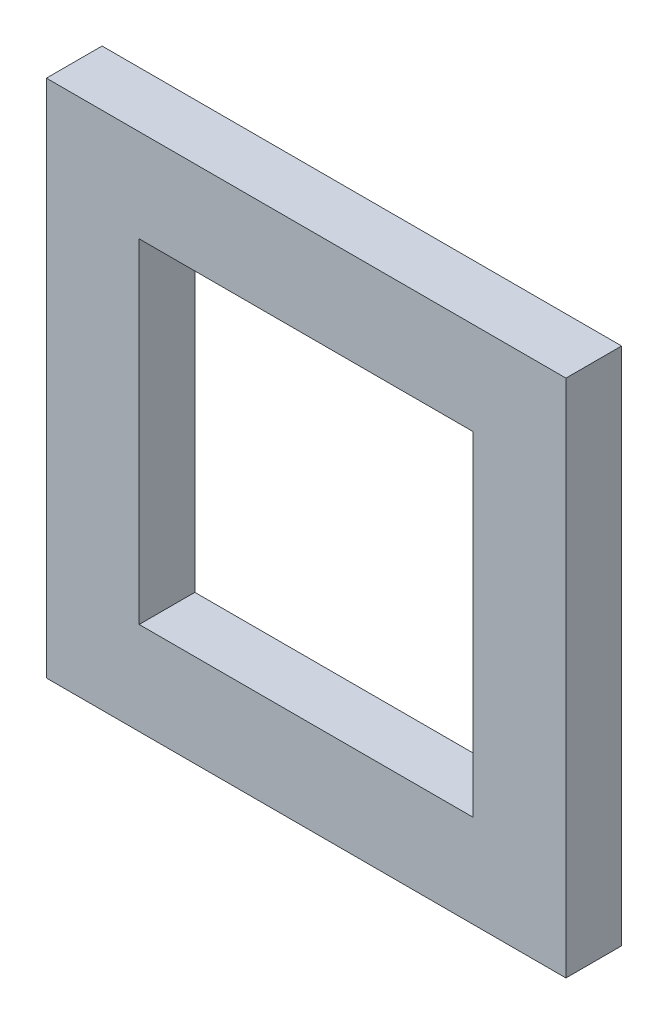
from build123d import *

# Parameters (mm, degrees)
SKETCH1_W     = 28
SKETCH1_H     = 28
SKETCH1_W_2   = 18
SKETCH1_H_2   = 18
PROFILE_DEPTH = 3


with BuildPart() as part:
    # Sketch1 → Profile (new body)
    with BuildSketch(Plane.XY):
        with Locations((14, 14)):
            Rectangle(SKETCH1_W, SKETCH1_H)
        with Locations((14, 14)):
            Rectangle(SKETCH1_W_2, SKETCH1_H_2, mode=Mode.SUBTRACT)
    extrude(amount=PROFILE_DEPTH)


solid = part.part
